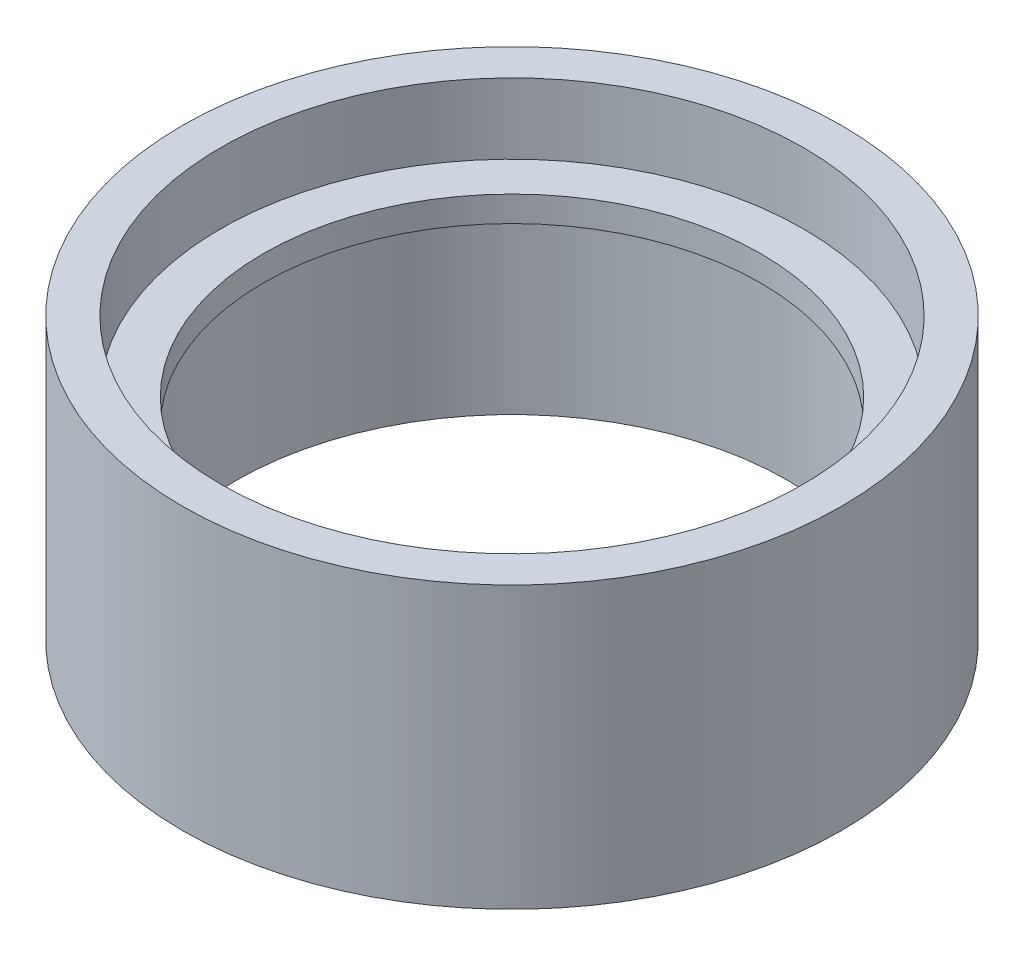
from build123d import *

# Parameters (mm, degrees)
SKETCH3_R           = 29.0195
SKETCH3_R_2         = 24.765
BOSS_EXTRUDE2_DEPTH = 2.54
SKETCH4_R           = 32.8295
SKETCH4_R_2         = 29.0195
BOSS_EXTRUDE3_DEPTH = 9.5504
BOSS_EXTRUDE4_START = 18.415
SKETCH5_R           = 32.8295
SKETCH5_R_2         = 27.5082
BOSS_EXTRUDE4_DEPTH = 18.415


with BuildPart() as part:
    # Sketch3 → Boss-Extrude2 (new body)
    with BuildSketch(Plane(origin=(0, 0, 0), x_dir=(1, 0, 0), z_dir=(0, 1, 0))):
        with Locations(Location((0, 0, 0), (0, 0, 270))):
            Circle(SKETCH3_R)
        with Locations(Location((0, 0, 0), (0, 0, 270))):
            Circle(SKETCH3_R_2, mode=Mode.SUBTRACT)
    extrude(amount=BOSS_EXTRUDE2_DEPTH)

    # Sketch4 → Boss-Extrude3 (add)
    with BuildSketch(Plane(origin=(0, 0, 0), x_dir=(1, 0, 0), z_dir=(0, 1, 0))):
        with Locations(Location((0, 0, 0), (0, 0, 90))):
            Circle(SKETCH4_R)
        with Locations(Location((0, 0, 0), (0, 0, 90))):
            Circle(SKETCH4_R_2, mode=Mode.SUBTRACT)
    extrude(amount=BOSS_EXTRUDE3_DEPTH)

    # Sketch5 → Boss-Extrude4 (add)
    with BuildSketch(Plane.XZ.offset(BOSS_EXTRUDE4_START)):
        with Locations(Location((0, 0, 0), (0, 0, 270))):
            Circle(SKETCH5_R)
        with Locations(Location((0, 0, 0), (0, 0, 270))):
            Circle(SKETCH5_R_2, mode=Mode.SUBTRACT)
    extrude(amount=-BOSS_EXTRUDE4_DEPTH)


solid = part.part
